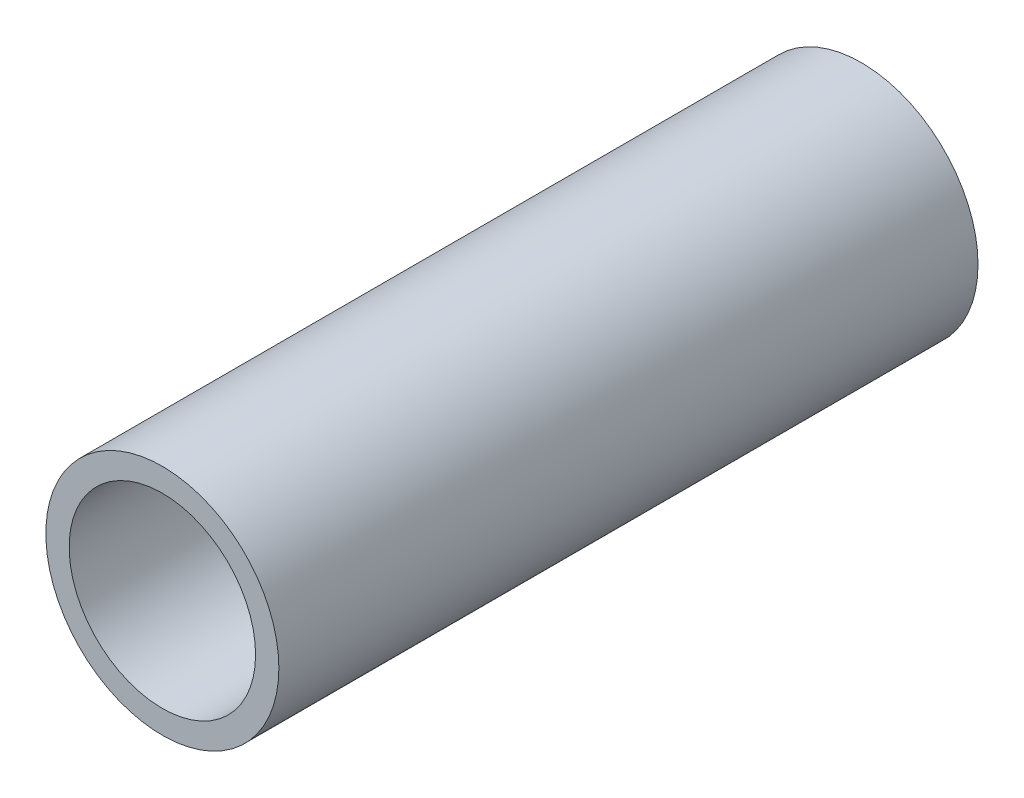
from build123d import *

# Parameters (mm, degrees)
SKETCH2_R           = 5
SKETCH2_R_2         = 4
BOSS_EXTRUDE1_DEPTH = 30


with BuildPart() as part:
    # Sketch2 → Boss-Extrude1 (new body)
    with BuildSketch(Plane.XY):
        Circle(SKETCH2_R)
        Circle(SKETCH2_R_2, mode=Mode.SUBTRACT)
    extrude(amount=BOSS_EXTRUDE1_DEPTH)


solid = part.part
